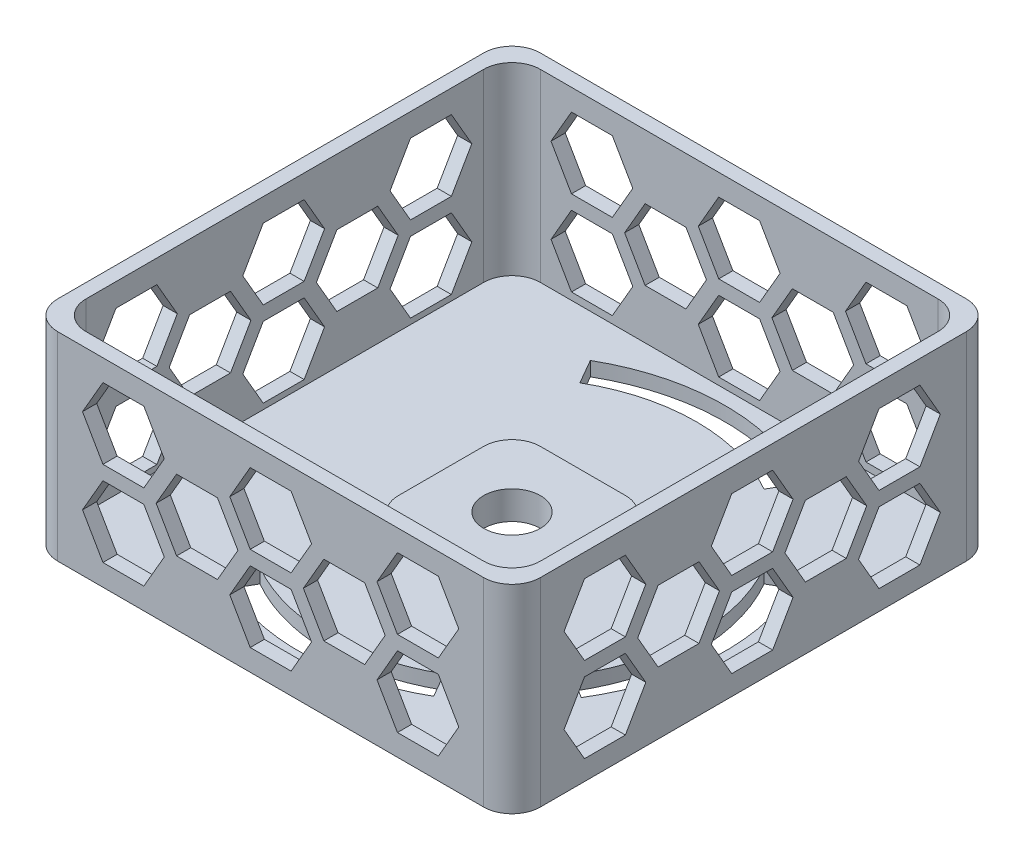
from build123d import *

# Parameters (mm, degrees)
BOSS_EXTRUDE1_DEPTH = 70
CUT_EXTRUDE1_DEPTH  = 65
CUT_EXTRUDE2_DEPTH  = 195
CUT_EXTRUDE4_REACH  = 252.4
LPATTERN1_COUNT     = 2
LPATTERN1_PITCH     = 50
BOSS_EXTRUDE3_DEPTH = 5
CUT_EXTRUDE5_REACH  = 249.79
SKETCH15_R          = 10


with BuildPart() as part:
    # Sketch1 → Boss-Extrude1 (new body)
    with BuildSketch(Plane(origin=(0, 0, 0), x_dir=(1, 0, 0), z_dir=(0, 1, 0))):
        with BuildLine():
            Line((10, 0), (160, 0))
            ThreePointArc((160, 0), (167.071067812, 2.928932188), (170, 10))
            Line((170, 10), (170, 160))
            ThreePointArc((170, 160), (167.071067812, 167.071067812), (160, 170))
            Line((160, 170), (10, 170))
            ThreePointArc((10, 170), (2.928932188, 167.071067812), (0, 160))
            Line((0, 160), (0, 10))
            ThreePointArc((0, 10), (2.928932188, 2.928932188), (10, 0))
        make_face()
    extrude(amount=BOSS_EXTRUDE1_DEPTH)

    # Sketch2 → Cut-Extrude1 (cut)
    with BuildSketch(Plane(origin=(0, 70, 0), x_dir=(1, 0, 0), z_dir=(0, 1, 0))):
        with BuildLine():
            Line((15, 5), (155, 5))
            ThreePointArc((155, 5), (162.071067812, 7.928932188), (165, 15))
            Line((165, 15), (165, 155))
            ThreePointArc((165, 155), (162.071067812, 162.071067812), (155, 165))
            Line((155, 165), (15, 165))
            ThreePointArc((15, 165), (7.928932188, 162.071067812), (5, 155))
            Line((5, 155), (5, 15))
            ThreePointArc((5, 15), (7.928932188, 7.928932188), (15, 5))
        make_face()
    extrude(amount=-CUT_EXTRUDE1_DEPTH, mode=Mode.SUBTRACT)

    # Sketch5 → Cut-Extrude2 (cut)
    with BuildSketch(Plane.XY):
        Polygon((47.53971906, 49.97075), (40.33971953, 62.441515), (25.93972047, 62.441515), (18.73972094, 49.97075), (25.93972047, 37.499985), (40.33971953, 37.499985), align=None)
        Polygon((99.39999906, 49.97075), (92.19999953, 62.441515), (77.80000047, 62.441515), (70.60000094, 49.97075), (77.80000047, 37.499985), (92.19999953, 37.499985), align=None)
        Polygon((151.26027906, 49.97075), (144.06027953, 62.441515), (129.66028047, 62.441515), (122.46028094, 49.97075), (129.66028047, 37.499985), (144.06027953, 37.499985), align=None)
        Polygon((99.39999906, 20.02925), (92.19999953, 32.500015), (77.80000047, 32.500015), (70.60000094, 20.02925), (77.80000047, 7.558485), (92.19999953, 7.558485), align=None)
        Polygon((47.53971906, 20.02925), (40.33971953, 32.500015), (25.93972047, 32.500015), (18.73972094, 20.02925), (25.93972047, 7.558485), (40.33971953, 7.558485), align=None)
        Polygon((151.26027906, 20.02925), (144.06027953, 32.500015), (129.66028047, 32.500015), (122.46028094, 20.02925), (129.66028047, 7.558485), (144.06027953, 7.558485), align=None)
        Polygon((73.46985906, 35), (66.26985953, 47.470765), (51.86986047, 47.470765), (44.66986094, 35), (51.86986047, 22.529235), (66.26985953, 22.529235), align=None)
        Polygon((125.33013906, 35), (118.13013953, 47.470765), (103.73014047, 47.470765), (96.53014094, 35), (103.73014047, 22.529235), (118.13013953, 22.529235), align=None)
    extrude(amount=-CUT_EXTRUDE2_DEPTH, mode=Mode.SUBTRACT)

    # Sketch13 → Cut-Extrude4 (cut, up to next)
    with BuildSketch(Plane(origin=(170, 0, 0), x_dir=(0, 0, -1), z_dir=(1, 0, 0)), mode=Mode.PRIVATE) as cut_extrude4_sk1:
        Polygon((47.127845985, 49.408840731), (39.927846455, 61.879605731), (25.527847396, 61.879605731), (18.327847866, 49.408840731), (25.527847396, 36.938075731), (39.927846455, 36.938075731), align=None)
    cut_extrude4_tool1 = extrude(cut_extrude4_sk1.sketch, amount=-CUT_EXTRUDE4_REACH, mode=Mode.PRIVATE) & part.part
    # Sketch13 → Cut-Extrude4 (cut, up to next)
    with BuildSketch(Plane(origin=(170, 0, 0), x_dir=(0, 0, -1), z_dir=(1, 0, 0)), mode=Mode.PRIVATE) as cut_extrude4_sk2:
        Polygon((98.988125985, 49.408840731), (91.788126455, 61.879605731), (77.388127396, 61.879605731), (70.188127866, 49.408840731), (77.388127396, 36.938075731), (91.788126455, 36.938075731), align=None)
    cut_extrude4_tool2 = extrude(cut_extrude4_sk2.sketch, amount=-CUT_EXTRUDE4_REACH, mode=Mode.PRIVATE) & part.part
    # Sketch13 → Cut-Extrude4 (cut, up to next)
    with BuildSketch(Plane(origin=(170, 0, 0), x_dir=(0, 0, -1), z_dir=(1, 0, 0)), mode=Mode.PRIVATE) as cut_extrude4_sk3:
        Polygon((150.848405985, 49.408840731), (143.648406455, 61.879605731), (129.248407396, 61.879605731), (122.048407866, 49.408840731), (129.248407396, 36.938075731), (143.648406455, 36.938075731), align=None)
    cut_extrude4_tool3 = extrude(cut_extrude4_sk3.sketch, amount=-CUT_EXTRUDE4_REACH, mode=Mode.PRIVATE) & part.part
    # Sketch13 → Cut-Extrude4 (cut, up to next)
    with BuildSketch(Plane(origin=(170, 0, 0), x_dir=(0, 0, -1), z_dir=(1, 0, 0)), mode=Mode.PRIVATE) as cut_extrude4_sk4:
        Polygon((98.988125985, 19.467340731), (91.788126455, 31.938105731), (77.388127396, 31.938105731), (70.188127866, 19.467340731), (77.388127396, 6.996575731), (91.788126455, 6.996575731), align=None)
    cut_extrude4_tool4 = extrude(cut_extrude4_sk4.sketch, amount=-CUT_EXTRUDE4_REACH, mode=Mode.PRIVATE) & part.part
    # Sketch13 → Cut-Extrude4 (cut, up to next)
    with BuildSketch(Plane(origin=(170, 0, 0), x_dir=(0, 0, -1), z_dir=(1, 0, 0)), mode=Mode.PRIVATE) as cut_extrude4_sk5:
        Polygon((47.127845985, 19.467340731), (39.927846455, 31.938105731), (25.527847396, 31.938105731), (18.327847866, 19.467340731), (25.527847396, 6.996575731), (39.927846455, 6.996575731), align=None)
    cut_extrude4_tool5 = extrude(cut_extrude4_sk5.sketch, amount=-CUT_EXTRUDE4_REACH, mode=Mode.PRIVATE) & part.part
    # Sketch13 → Cut-Extrude4 (cut, up to next)
    with BuildSketch(Plane(origin=(170, 0, 0), x_dir=(0, 0, -1), z_dir=(1, 0, 0)), mode=Mode.PRIVATE) as cut_extrude4_sk6:
        Polygon((150.848405985, 19.467340731), (143.648406455, 31.938105731), (129.248407396, 31.938105731), (122.048407866, 19.467340731), (129.248407396, 6.996575731), (143.648406455, 6.996575731), align=None)
    cut_extrude4_tool6 = extrude(cut_extrude4_sk6.sketch, amount=-CUT_EXTRUDE4_REACH, mode=Mode.PRIVATE) & part.part
    # Sketch13 → Cut-Extrude4 (cut, up to next)
    with BuildSketch(Plane(origin=(170, 0, 0), x_dir=(0, 0, -1), z_dir=(1, 0, 0)), mode=Mode.PRIVATE) as cut_extrude4_sk7:
        Polygon((73.057985985, 34.438090731), (65.857986455, 46.908855731), (51.457987396, 46.908855731), (44.257987866, 34.438090731), (51.457987396, 21.967325731), (65.857986455, 21.967325731), align=None)
    cut_extrude4_tool7 = extrude(cut_extrude4_sk7.sketch, amount=-CUT_EXTRUDE4_REACH, mode=Mode.PRIVATE) & part.part
    # Sketch13 → Cut-Extrude4 (cut, up to next)
    with BuildSketch(Plane(origin=(170, 0, 0), x_dir=(0, 0, -1), z_dir=(1, 0, 0)), mode=Mode.PRIVATE) as cut_extrude4_sk8:
        Polygon((124.918265985, 34.438090731), (117.718266455, 46.908855731), (103.318267396, 46.908855731), (96.118267866, 34.438090731), (103.318267396, 21.967325731), (117.718266455, 21.967325731), align=None)
    cut_extrude4_tool8 = extrude(cut_extrude4_sk8.sketch, amount=-CUT_EXTRUDE4_REACH, mode=Mode.PRIVATE) & part.part
    cut_extrude4_1 = cut_extrude4_tool1.solids().sort_by_distance((170, 49.408841, -32.727847))[0]
    add(cut_extrude4_1, mode=Mode.SUBTRACT)
    cut_extrude4_2 = cut_extrude4_tool2.solids().sort_by_distance((170, 49.408841, -84.588127))[0]
    add(cut_extrude4_2, mode=Mode.SUBTRACT)
    cut_extrude4_3 = cut_extrude4_tool3.solids().sort_by_distance((170, 49.408841, -136.448407))[0]
    add(cut_extrude4_3, mode=Mode.SUBTRACT)
    cut_extrude4_4 = cut_extrude4_tool4.solids().sort_by_distance((170, 19.467341, -84.588127))[0]
    add(cut_extrude4_4, mode=Mode.SUBTRACT)
    cut_extrude4_5 = cut_extrude4_tool5.solids().sort_by_distance((170, 19.467341, -32.727847))[0]
    add(cut_extrude4_5, mode=Mode.SUBTRACT)
    cut_extrude4_6 = cut_extrude4_tool6.solids().sort_by_distance((170, 19.467341, -136.448407))[0]
    add(cut_extrude4_6, mode=Mode.SUBTRACT)
    cut_extrude4_7 = cut_extrude4_tool7.solids().sort_by_distance((170, 34.438091, -58.657987))[0]
    add(cut_extrude4_7, mode=Mode.SUBTRACT)
    cut_extrude4_8 = cut_extrude4_tool8.solids().sort_by_distance((170, 34.438091, -110.518267))[0]
    add(cut_extrude4_8, mode=Mode.SUBTRACT)
    cut_extrude4 = cut_extrude4_1 + cut_extrude4_2 + cut_extrude4_3 + cut_extrude4_4 + cut_extrude4_5 + cut_extrude4_6 + cut_extrude4_7 + cut_extrude4_8  # Cut-Extrude4 as one shape, for the pattern or mirror that repeats it

    # LPattern1: Cut-Extrude4; each copy of Cut-Extrude4 runs up to whatever stops it at its own place
    lpattern1_before = part.part  # the part as the pattern finds it: every copy runs up to it
    lpattern1_cut_extrude4_long1 = extrude(cut_extrude4_sk1.sketch, amount=-CUT_EXTRUDE4_REACH, mode=Mode.PRIVATE)
    lpattern1_cut_extrude4_long2 = extrude(cut_extrude4_sk2.sketch, amount=-CUT_EXTRUDE4_REACH, mode=Mode.PRIVATE)
    lpattern1_cut_extrude4_long3 = extrude(cut_extrude4_sk3.sketch, amount=-CUT_EXTRUDE4_REACH, mode=Mode.PRIVATE)
    lpattern1_cut_extrude4_long4 = extrude(cut_extrude4_sk4.sketch, amount=-CUT_EXTRUDE4_REACH, mode=Mode.PRIVATE)
    lpattern1_cut_extrude4_long5 = extrude(cut_extrude4_sk5.sketch, amount=-CUT_EXTRUDE4_REACH, mode=Mode.PRIVATE)
    lpattern1_cut_extrude4_long6 = extrude(cut_extrude4_sk6.sketch, amount=-CUT_EXTRUDE4_REACH, mode=Mode.PRIVATE)
    lpattern1_cut_extrude4_long7 = extrude(cut_extrude4_sk7.sketch, amount=-CUT_EXTRUDE4_REACH, mode=Mode.PRIVATE)
    lpattern1_cut_extrude4_long8 = extrude(cut_extrude4_sk8.sketch, amount=-CUT_EXTRUDE4_REACH, mode=Mode.PRIVATE)
    lpattern1_cut_extrude4_tool1_1 = lpattern1_cut_extrude4_long1.moved(Location(Vector(-1, 0, 0) * (1 * LPATTERN1_PITCH))) & lpattern1_before
    add(lpattern1_cut_extrude4_tool1_1.solids().sort_by_distance((120, 49.408841, -32.727847))[0], mode=Mode.SUBTRACT)
    lpattern1_cut_extrude4_tool2_1 = lpattern1_cut_extrude4_long2.moved(Location(Vector(-1, 0, 0) * (1 * LPATTERN1_PITCH))) & lpattern1_before
    add(lpattern1_cut_extrude4_tool2_1.solids().sort_by_distance((120, 49.408841, -84.588127))[0], mode=Mode.SUBTRACT)
    lpattern1_cut_extrude4_tool3_1 = lpattern1_cut_extrude4_long3.moved(Location(Vector(-1, 0, 0) * (1 * LPATTERN1_PITCH))) & lpattern1_before
    add(lpattern1_cut_extrude4_tool3_1.solids().sort_by_distance((120, 49.408841, -136.448407))[0], mode=Mode.SUBTRACT)
    lpattern1_cut_extrude4_tool4_1 = lpattern1_cut_extrude4_long4.moved(Location(Vector(-1, 0, 0) * (1 * LPATTERN1_PITCH))) & lpattern1_before
    add(lpattern1_cut_extrude4_tool4_1.solids().sort_by_distance((120, 19.467341, -84.588127))[0], mode=Mode.SUBTRACT)
    lpattern1_cut_extrude4_tool5_1 = lpattern1_cut_extrude4_long5.moved(Location(Vector(-1, 0, 0) * (1 * LPATTERN1_PITCH))) & lpattern1_before
    add(lpattern1_cut_extrude4_tool5_1.solids().sort_by_distance((120, 19.467341, -32.727847))[0], mode=Mode.SUBTRACT)
    lpattern1_cut_extrude4_tool6_1 = lpattern1_cut_extrude4_long6.moved(Location(Vector(-1, 0, 0) * (1 * LPATTERN1_PITCH))) & lpattern1_before
    add(lpattern1_cut_extrude4_tool6_1.solids().sort_by_distance((120, 19.467341, -136.448407))[0], mode=Mode.SUBTRACT)
    lpattern1_cut_extrude4_tool7_1 = lpattern1_cut_extrude4_long7.moved(Location(Vector(-1, 0, 0) * (1 * LPATTERN1_PITCH))) & lpattern1_before
    add(lpattern1_cut_extrude4_tool7_1.solids().sort_by_distance((120, 34.438091, -58.657987))[0], mode=Mode.SUBTRACT)
    lpattern1_cut_extrude4_tool8_1 = lpattern1_cut_extrude4_long8.moved(Location(Vector(-1, 0, 0) * (1 * LPATTERN1_PITCH))) & lpattern1_before
    add(lpattern1_cut_extrude4_tool8_1.solids().sort_by_distance((120, 34.438091, -110.518267))[0], mode=Mode.SUBTRACT)

    # Sketch14 → Boss-Extrude3 (add)
    with BuildSketch(Plane(origin=(0, 5, 0), x_dir=(1, 0, 0), z_dir=(0, 1, 0))):
        with BuildLine():
            Line((85, 60), (100, 60))
            ThreePointArc((100, 60), (107.071067812, 62.928932188), (110, 70))
            Line((110, 70), (110, 100))
            ThreePointArc((110, 100), (107.071067812, 107.071067812), (100, 110))
            Line((100, 110), (70, 110))
            ThreePointArc((70, 110), (62.928932188, 107.071067812), (60, 100))
            Line((60, 100), (60, 70))
            ThreePointArc((60, 70), (62.928932188, 62.928932188), (70, 60))
            Line((70, 60), (85, 60))
        make_face()
    extrude(amount=BOSS_EXTRUDE3_DEPTH)

    # Sketch15 → Cut-Extrude5 (cut, up to next)
    with BuildSketch(Plane(origin=(0, 10, 0), x_dir=(1, 0, 0), z_dir=(0, 1, 0)), mode=Mode.PRIVATE) as cut_extrude5_sk1:
        with Locations(Location((85, 85, 0), (0, 0, 270))):
            Circle(SKETCH15_R)
    cut_extrude5_tool1 = extrude(cut_extrude5_sk1.sketch, amount=-CUT_EXTRUDE5_REACH, mode=Mode.PRIVATE) & part.part
    # Sketch15 → Cut-Extrude5 (cut, up to next)
    with BuildSketch(Plane(origin=(0, 10, 0), x_dir=(1, 0, 0), z_dir=(0, 1, 0)), mode=Mode.PRIVATE) as cut_extrude5_sk2:
        with BuildLine():
            Line((52.572302648, 28.666666667), (47.583426132, 20))
            ThreePointArc((47.583426132, 20), (85, 10), (122.416573868, 20))
            Line((122.416573868, 20), (117.427697352, 28.666666667))
            ThreePointArc((117.427697352, 28.666666667), (85, 20), (52.572302648, 28.666666667))
        make_face()
    cut_extrude5_tool2 = extrude(cut_extrude5_sk2.sketch, amount=-CUT_EXTRUDE5_REACH, mode=Mode.PRIVATE) & part.part
    # Sketch15 → Cut-Extrude5 (cut, up to next)
    with BuildSketch(Plane(origin=(0, 10, 0), x_dir=(1, 0, 0), z_dir=(0, 1, 0)), mode=Mode.PRIVATE) as cut_extrude5_sk3:
        with BuildLine():
            Line((140.300425317, 50.840624131), (148.808183058, 45.585335536))
            ThreePointArc((148.808183058, 45.585335536), (159.990978135, 83.836729432), (150, 122.416573868))
            Line((150, 122.416573868), (141.333333333, 117.427697352))
            ThreePointArc((141.333333333, 117.427697352), (149.99218105, 83.991832175), (140.300425317, 50.840624131))
        make_face()
    cut_extrude5_tool3 = extrude(cut_extrude5_sk3.sketch, amount=-CUT_EXTRUDE5_REACH, mode=Mode.PRIVATE) & part.part
    # Sketch15 → Cut-Extrude5 (cut, up to next)
    with BuildSketch(Plane(origin=(0, 10, 0), x_dir=(1, 0, 0), z_dir=(0, 1, 0)), mode=Mode.PRIVATE) as cut_extrude5_sk4:
        with BuildLine():
            Line((47.583426132, 150), (52.572302648, 141.333333333))
            ThreePointArc((52.572302648, 141.333333333), (85, 150), (117.427697352, 141.333333333))
            Line((117.427697352, 141.333333333), (122.416573868, 150))
            ThreePointArc((122.416573868, 150), (85, 160), (47.583426132, 150))
        make_face()
    cut_extrude5_tool4 = extrude(cut_extrude5_sk4.sketch, amount=-CUT_EXTRUDE5_REACH, mode=Mode.PRIVATE) & part.part
    add(cut_extrude5_tool1.solids().sort_by_distance((85, 10, -85))[0], mode=Mode.SUBTRACT)
    add(cut_extrude5_tool2.solids().sort_by_distance((85, 10, -18.025973))[0], mode=Mode.SUBTRACT)
    add(cut_extrude5_tool3.solids().sort_by_distance((151.77917, 10, -83.964112))[0], mode=Mode.SUBTRACT)
    add(cut_extrude5_tool4.solids().sort_by_distance((85, 10, -151.974027))[0], mode=Mode.SUBTRACT)


solid = part.part
